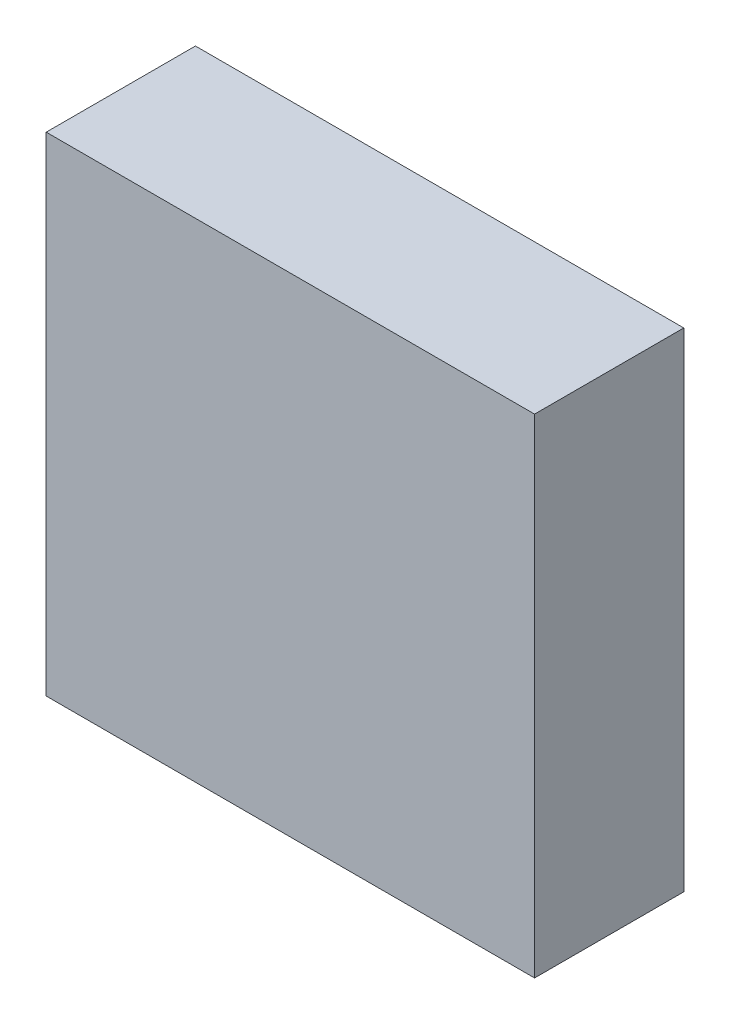
from build123d import *

# Parameters (mm, degrees)
SKETCH_1_W      = 36
SKETCH_1_H      = 36
EXTRUDE_1_DEPTH = 11


with BuildPart() as part:
    # 草图1 → 凸台-拉伸1 (new body)
    with BuildSketch(Plane.XY):
        Rectangle(SKETCH_1_W, SKETCH_1_H)
    extrude(amount=EXTRUDE_1_DEPTH)


solid = part.part
